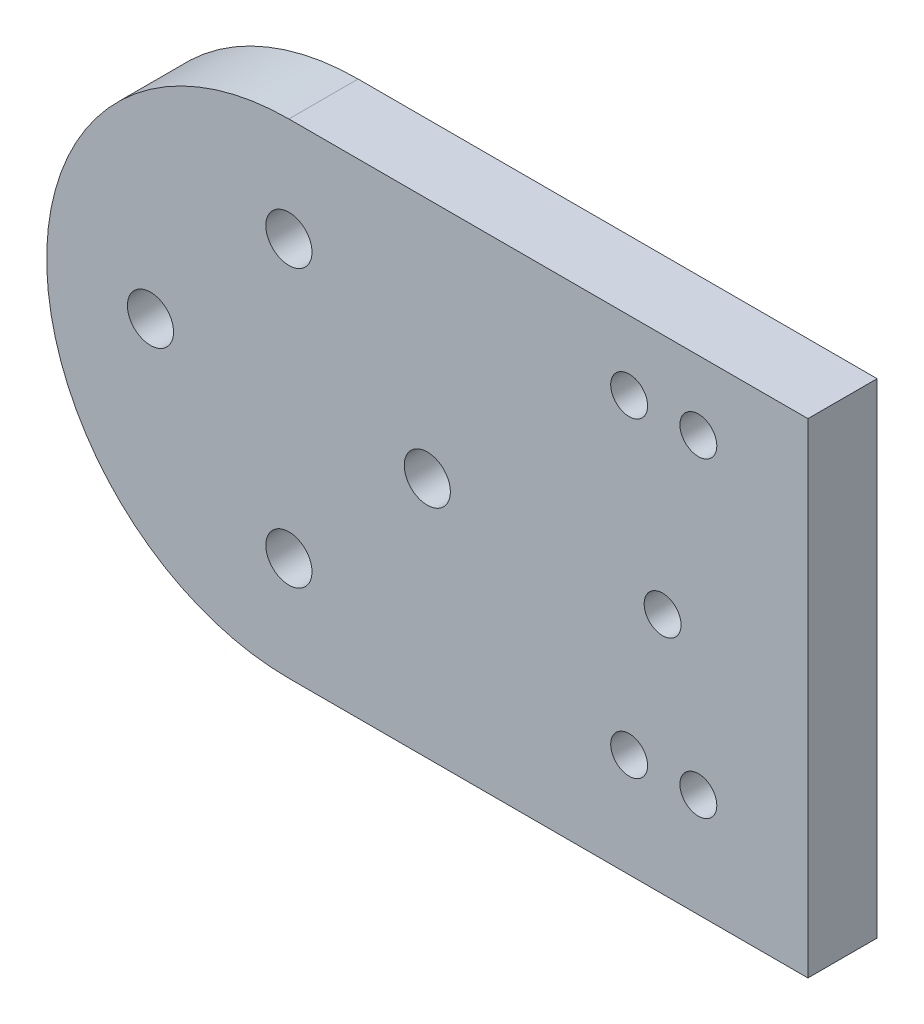
from build123d import *

# Parameters (mm, degrees)
SKETCH_1_W      = 15
SKETCH_1_H      = 42
SKETCH_1_R      = 1.6
SKETCH_1_W_2    = 5
EXTRUDE_1_DEPTH = 6


with BuildPart() as part:
    # 草图1 → 凸台-拉伸1 (new body)
    # profile 1 of 7: a face of its own
    with BuildSketch(Plane.XY):
        with BuildLine():
            Line((0, 14), (0, 21))
            ThreePointArc((0, 21), (-21, 0), (0, -21))
            Line((0, -21), (0, -14))
            ThreePointArc((0, -14), (-1.471960144, -13.354006401), (-1.993043457, -11.833333333))
            ThreePointArc((-1.993043457, -11.833333333), (-8.485281374, -8.485281374), (-11.833333333, -1.993043457))
            ThreePointArc((-11.833333333, -1.993043457), (-14, 0), (-11.833333333, 1.993043457))
            ThreePointArc((-11.833333333, 1.993043457), (-8.485281374, 8.485281374), (-1.993043457, 11.833333333))
            ThreePointArc((-1.993043457, 11.833333333), (-1.471960144, 13.354006401), (0, 14))
        make_face()
    # profile 2 of 7: a face of its own
    with BuildSketch(Plane.XY):
        with BuildLine():
            ThreePointArc((0, 10), (-1.354006401, 10.528039856), (-1.993043457, 11.833333333))
            ThreePointArc((-1.993043457, 11.833333333), (-8.485281374, 8.485281374), (-11.833333333, 1.993043457))
            ThreePointArc((-11.833333333, 1.993043457), (-10.528039856, 1.354006401), (-10, 0))
            ThreePointArc((-10, 0), (-10.528039856, -1.354006401), (-11.833333333, -1.993043457))
            ThreePointArc((-11.833333333, -1.993043457), (-8.485281374, -8.485281374), (-1.993043457, -11.833333333))
            ThreePointArc((-1.993043457, -11.833333333), (-1.354006401, -10.528039856), (0, -10))
            Line((0, -10), (0, 10))
        make_face()
    # profile 3 of 7: a face of its own
    with BuildSketch(Plane.XY):
        with BuildLine():
            ThreePointArc((1.993043457, 11.833333333), (1.354006401, 10.528039856), (0, 10))
            Line((0, 10), (0, -10))
            ThreePointArc((0, -10), (1.354006401, -10.528039856), (1.993043457, -11.833333333))
            ThreePointArc((1.993043457, -11.833333333), (8.485281374, -8.485281374), (11.833333333, -1.993043457))
            ThreePointArc((11.833333333, -1.993043457), (10, 0), (11.833333333, 1.993043457))
            ThreePointArc((11.833333333, 1.993043457), (8.485281374, 8.485281374), (1.993043457, 11.833333333))
        make_face()
    # profile 4 of 7: a face of its own
    with BuildSketch(Plane.XY):
        with BuildLine():
            ThreePointArc((21, 0), (14.849242405, 14.849242405), (0, 21))
            Line((0, 21), (0, 14))
            ThreePointArc((0, 14), (1.414213562, 13.414213562), (2, 12))
            ThreePointArc((2, 12), (1.998260107, 11.916594108), (1.993043457, 11.833333333))
            ThreePointArc((1.993043457, 11.833333333), (8.485281374, 8.485281374), (11.833333333, 1.993043457))
            ThreePointArc((11.833333333, 1.993043457), (13.354006401, 1.471960144), (14, 0))
            ThreePointArc((14, 0), (13.354006401, -1.471960144), (11.833333333, -1.993043457))
            ThreePointArc((11.833333333, -1.993043457), (8.485281374, -8.485281374), (1.993043457, -11.833333333))
            ThreePointArc((1.993043457, -11.833333333), (1.998260107, -11.916594108), (2, -12))
            ThreePointArc((2, -12), (1.414213562, -13.414213562), (0, -14))
            Line((0, -14), (0, -21))
            ThreePointArc((0, -21), (14.849242405, -14.849242405), (21, 0))
        make_face()
    # profile 5 of 7: a face of its own
    with BuildSketch(Plane.XY):
        with BuildLine():
            Line((25, 21), (0, 21))
            ThreePointArc((0, 21), (14.849242405, 14.849242405), (21, 0))
            ThreePointArc((21, 0), (14.849242405, -14.849242405), (0, -21))
            Line((0, -21), (25, -21))
            Line((25, -21), (25, 21))
        make_face()
    # profile 6 of 7: a face of its own
    with BuildSketch(Plane.XY):
        with Locations((32.5, 0)):
            Rectangle(SKETCH_1_W, SKETCH_1_H)
        with Locations((32.4, 0)):
            Circle(SKETCH_1_R, mode=Mode.SUBTRACT)
        with Locations((29.5, -12)):
            Circle(SKETCH_1_R, mode=Mode.SUBTRACT)
        with Locations((35.5, -12)):
            Circle(SKETCH_1_R, mode=Mode.SUBTRACT)
        with Locations((35.5, 15)):
            Circle(SKETCH_1_R, mode=Mode.SUBTRACT)
        with Locations((29.5, 15)):
            Circle(SKETCH_1_R, mode=Mode.SUBTRACT)
    # profile 7 of 7: a face of its own
    with BuildSketch(Plane.XY):
        with Locations((42.5, 0)):
            Rectangle(SKETCH_1_W_2, SKETCH_1_H)
    extrude(amount=EXTRUDE_1_DEPTH)


solid = part.part
